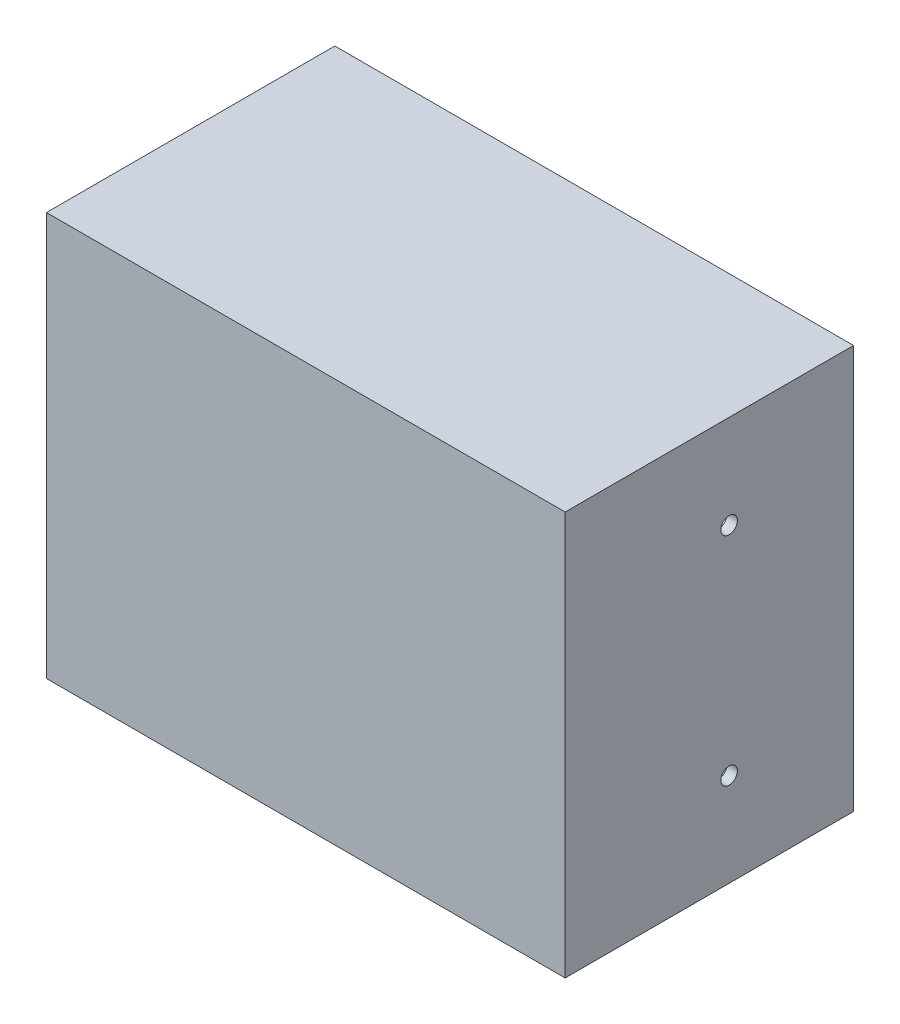
from build123d import *

# Parameters (mm, degrees)
SKIZZE1_W                       = 250
SKIZZE1_H                       = 194.5
AUFSATZ_LINEAR_AUSTRAGEN1_DEPTH = 139
SKIZZE2_W                       = 240
SKIZZE2_H                       = 184.5
SCHNITT_LINEAR_AUSTRAGEN1_DEPTH = 134
F_8_0MM_STIFTLOCH1_D            = 8


with BuildPart() as part:
    # Skizze1 → Aufsatz-Linear austragen1 (new body)
    with BuildSketch(Plane.XY):
        Rectangle(SKIZZE1_W, SKIZZE1_H)
    extrude(amount=AUFSATZ_LINEAR_AUSTRAGEN1_DEPTH)

    # Skizze2 → Schnitt-Linear austragen1 (cut)
    with BuildSketch(Plane(origin=(0, 0, 0), x_dir=(-1, 0, 0), z_dir=(0, 0, -1))):
        Rectangle(SKIZZE2_W, SKIZZE2_H)
    extrude(amount=-SCHNITT_LINEAR_AUSTRAGEN1_DEPTH, mode=Mode.SUBTRACT)

    # Ø8.0mm Stiftloch1 (through all)
    with Locations(Plane.ZY.offset(125)):
        with Locations((60, -52.25)):
            f_8_0mm_stiftloch1 = Hole(F_8_0MM_STIFTLOCH1_D / 2)

    # Spiegeln1: Ø8.0mm Stiftloch1 across plane
    add(f_8_0mm_stiftloch1.mirror(Plane.ZX), mode=Mode.SUBTRACT)


solid = part.part
